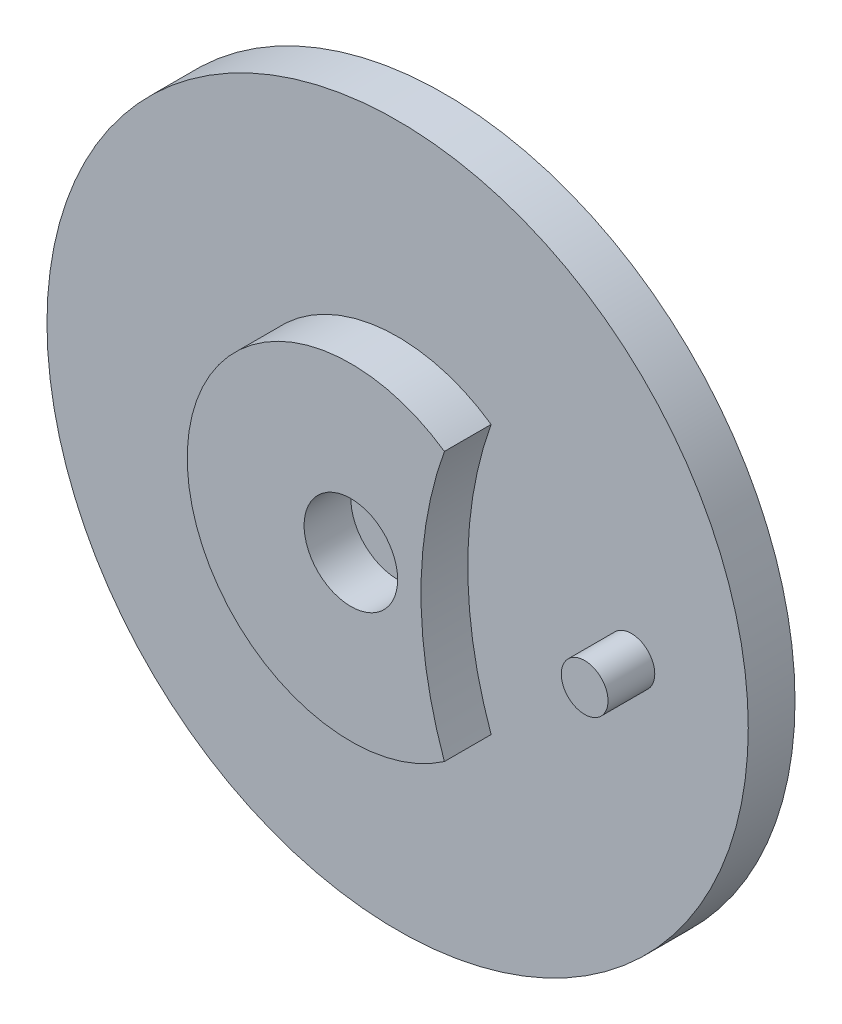
from build123d import *

# Parameters (mm, degrees)
CROQUIS1_R              = 75
SALIENTE_EXTRUIR1_DEPTH = 20
CROQUIS2_R              = 10
CORTAR_EXTRUIR1_DEPTH   = 10
CORTAR_EXTRUIR2_START   = -10
CROQUIS3_R              = 75
CROQUIS3_R_2            = 35
CORTAR_EXTRUIR2_DEPTH   = 10
CROQUIS4_R              = 5
SALIENTE_EXTRUIR3_DEPTH = 10
CORTAR_EXTRUIR3_START   = -10
CORTAR_EXTRUIR3_DEPTH   = 10


with BuildPart() as part:
    # Croquis1 → Saliente-Extruir1 (new body)
    with BuildSketch(Plane.XY):
        Circle(CROQUIS1_R)
    extrude(amount=SALIENTE_EXTRUIR1_DEPTH)

    # Croquis2 → Cortar-Extruir1 (cut)
    with BuildSketch(Plane.XY.offset(20)):
        Circle(CROQUIS2_R)
    extrude(amount=-CORTAR_EXTRUIR1_DEPTH, mode=Mode.SUBTRACT)

    # Croquis3 → Cortar-Extruir2 (cut)
    with BuildSketch(Plane.XY.offset(20).offset(CORTAR_EXTRUIR2_START)):
        Circle(CROQUIS3_R)
        Circle(CROQUIS3_R_2, mode=Mode.SUBTRACT)
    extrude(amount=CORTAR_EXTRUIR2_DEPTH, mode=Mode.SUBTRACT)

    # Croquis4 → Saliente-Extruir3 (add)
    with BuildSketch(Plane.XY.offset(10)):
        with Locations((50, 0)):
            Circle(CROQUIS4_R)
    extrude(amount=SALIENTE_EXTRUIR3_DEPTH)

    # Croquis5 → Cortar-Extruir3 (cut)
    with BuildSketch(Plane.XY.offset(20).offset(CORTAR_EXTRUIR3_START)):
        with BuildLine():
            ThreePointArc((20, 28.722813233), (15, 0), (20, -28.722813233))
            ThreePointArc((20, -28.722813233), (35, 0), (20, 28.722813233))
        make_face()
    extrude(amount=CORTAR_EXTRUIR3_DEPTH, mode=Mode.SUBTRACT)


solid = part.part
